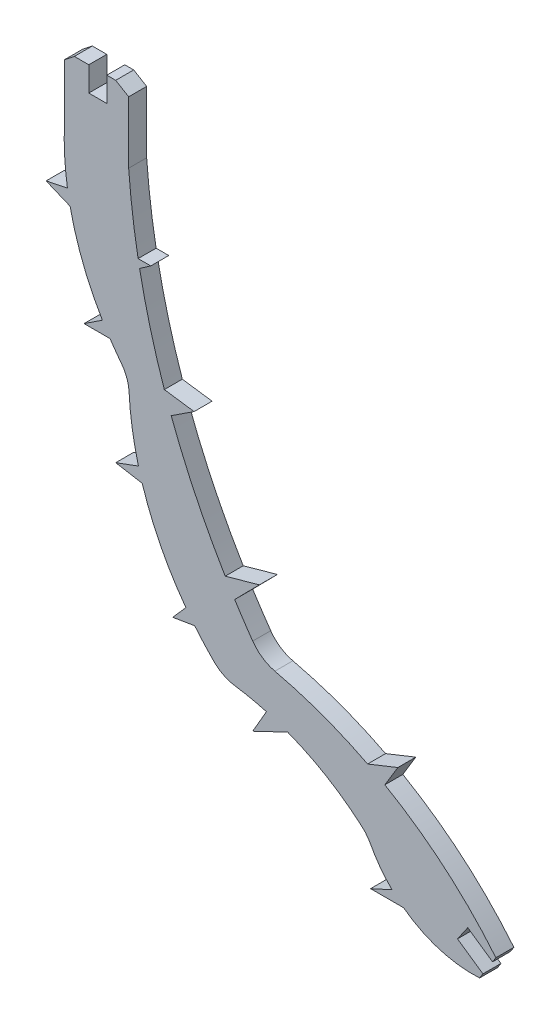
from build123d import *

# Parameters (mm, degrees)
BOSS_EXTRUDE1_DEPTH = 1.524


with BuildPart() as part:
    # Sketch1 → Boss-Extrude1 (new body)
    with BuildSketch(Plane.XY):
        with BuildLine():
            Line((0, -7.482967549), (0, -5.408604084))
            Line((0, -5.408604084), (0.755403654, -5.408604084))
            Line((0.755403654, -5.408604084), (1.852982052, -6.066483394))
            Line((1.852982052, -6.066483394), (1.852982052, -11.302742268))
            ThreePointArc((1.852982052, -11.302742268), (2.169015936, -14.427077895), (2.651362341, -17.530091345))
            Line((2.651362341, -17.530091345), (3.723597325, -17.530091345))
            Line((3.723597325, -17.530091345), (2.776349352, -18.191976001))
            ThreePointArc((2.776349352, -18.191976001), (3.688558171, -22.143924571), (4.870971382, -26.023605155))
            Line((4.870971382, -26.023605155), (7.391844245, -26.375500189))
            Line((7.391844245, -26.375500189), (5.453722899, -27.64535428))
            ThreePointArc((5.453722899, -27.64535428), (7.526914303, -32.489040294), (10.025271266, -37.127750167))
            Line((10.025271266, -37.127750167), (12.920376423, -36.313179973))
            Line((12.920376423, -36.313179973), (10.828892653, -38.432980418))
            ThreePointArc((10.828892653, -38.432980418), (11.578167935, -39.585157678), (12.354161774, -40.719511876))
            ThreePointArc((12.354161774, -40.719511876), (13.175512701, -41.52681366), (14.230806956, -41.988015948))
            ThreePointArc((14.230806956, -41.988015948), (18.242644995, -43.188625247), (22.0780899, -44.869598037))
            Line((22.0780899, -44.869598037), (24.637655179, -43.847936826))
            Line((24.637655179, -43.847936826), (23.540004987, -45.665371924))
            ThreePointArc((23.540004987, -45.665371924), (28.601111191, -49.226757072), (32.939174514, -53.640311963))
            Line((32.939174514, -53.640311963), (32.658498476, -54.083761868))
            Line((32.658498476, -54.083761868), (30.557652989, -52.629850356))
            Line((30.557652989, -52.629850356), (29.690386669, -53.883016398))
            Line((29.690386669, -53.883016398), (31.842754445, -55.372584435))
            Line((31.842754445, -55.372584435), (31.562078407, -55.81603434))
            ThreePointArc((31.562078407, -55.81603434), (28.171023999, -55.419868819), (25.12237155, -53.883016398))
            Line((25.12237155, -53.883016398), (22.328692601, -53.883016398))
            Line((22.328692601, -53.883016398), (24.149817082, -53.050998637))
            ThreePointArc((24.149817082, -53.050998637), (23.14393246, -51.90329893), (22.328692601, -50.613181701))
            ThreePointArc((22.328692601, -50.613181701), (22.010972611, -50.125385322), (21.609531214, -49.703797722))
            ThreePointArc((21.609531214, -49.703797722), (18.629634099, -47.531264185), (15.315052581, -45.914712875))
            Line((15.315052581, -45.914712875), (12.354161774, -47.327855997))
            Line((12.354161774, -47.327855997), (13.514091924, -45.317136512))
            ThreePointArc((13.514091924, -45.317136512), (12.19400152, -44.990393779), (10.855498604, -44.749957856))
            ThreePointArc((10.855498604, -44.749957856), (9.886950862, -44.4440491), (9.0645671, -43.847936826))
            ThreePointArc((9.0645671, -43.847936826), (8.232032183, -42.969369623), (7.443407514, -42.051183451))
            Line((7.443407514, -42.051183451), (5.583711581, -42.361832951))
            Line((5.583711581, -42.361832951), (6.698610636, -41.092910194))
            ThreePointArc((6.698610636, -41.092910194), (4.549160992, -37.615074341), (3.001052455, -33.831050562))
            Line((3.001052455, -33.831050562), (0.755403654, -33.442087733))
            Line((0.755403654, -33.442087733), (2.67955584, -32.723173894))
            ThreePointArc((2.67955584, -32.723173894), (2.152644596, -30.220357528), (1.886622718, -27.676549835))
            ThreePointArc((1.886622718, -27.676549835), (1.691331674, -26.735134405), (1.223200745, -25.895339764))
            ThreePointArc((1.223200745, -25.895339764), (0.738155144, -25.247811098), (0.2762274, -24.583593236))
            Line((0.2762274, -24.583593236), (-1.923937021, -24.583593236))
            Line((-1.923937021, -24.583593236), (-0.371702809, -23.55840282))
            ThreePointArc((-0.371702809, -23.55840282), (-2.026872481, -20.176102129), (-3.106855858, -16.568723508))
            Line((-3.106855858, -16.568723508), (-5.135572794, -15.725098738))
            Line((-5.135572794, -15.725098738), (-3.3310132, -15.34916898))
            ThreePointArc((-3.3310132, -15.34916898), (-3.571541774, -13.056715378), (-3.580970503, -10.751697242))
            Line((-3.580970503, -10.751697242), (-3.580970503, -6.064514361))
            Line((-3.580970503, -6.064514361), (-2.747975023, -5.406635051))
            Line((-2.747975023, -5.406635051), (-1.524, -5.406635051))
            Line((-1.524, -5.406635051), (-1.524, -7.482967549))
            Line((-1.524, -7.482967549), (0, -7.482967549))
        make_face()
    extrude(amount=BOSS_EXTRUDE1_DEPTH)


solid = part.part
